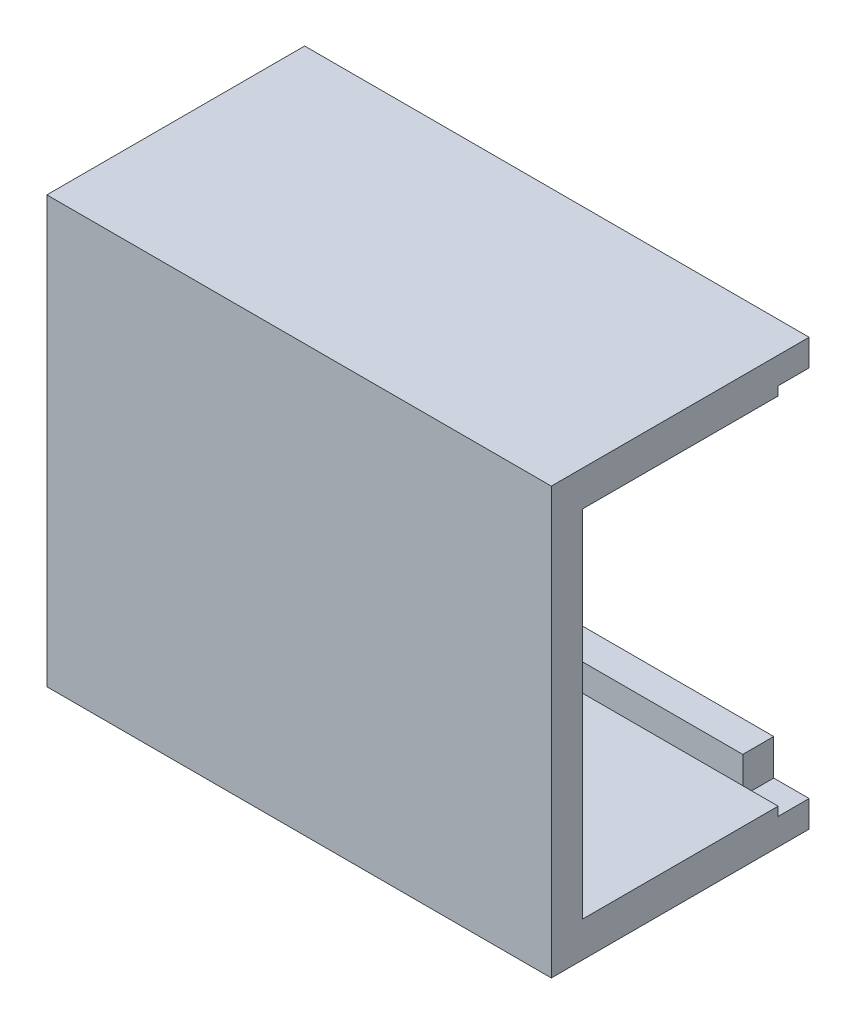
from build123d import *

# Parameters (mm, degrees)
SKETCH1_W           = 24.0664
SKETCH1_H           = 28.5
BOSS_EXTRUDE1_DEPTH = 14.5651
CUT_EXTRUDE1_DEPTH  = 35.193421008
CUT_EXTRUDE2_DEPTH  = 2


with BuildPart() as part:
    # Sketch1 → Boss-Extrude1 (new body)
    with BuildSketch(Plane(origin=(0, 0, 0), x_dir=(0, 1, 0), z_dir=(0, 0, 1))):
        Rectangle(SKETCH1_W, SKETCH1_H)
    extrude(amount=BOSS_EXTRUDE1_DEPTH)

    # Sketch2 → Cut-Extrude1 (cut, through all)
    with BuildSketch(Plane.YZ.offset(14.25)):
        Polygon((-10.0332, 12.8151), (10.0332, 12.8151), (10.0332, 1.75), (8.5, 1.75), (8.5, 0), (-8.5, 0), (-8.5, 1.75), (-10.0332, 1.75), align=None)
    extrude(amount=-CUT_EXTRUDE1_DEPTH, mode=Mode.SUBTRACT)

    # Sketch4 → Cut-Extrude2 (cut)
    with BuildSketch(Plane.YZ.offset(14.25)):
        Polygon((10.0332, 1.75), (10.5332, 1.75), (10.5332, 0), (8.5, 0), (8.5, 1.75), align=None)
        Polygon((-10.5332, 0), (-10.5332, 1.75), (-10.0332, 1.75), (-8.5, 1.75), (-8.5, 0), align=None)
    extrude(amount=-CUT_EXTRUDE2_DEPTH, mode=Mode.SUBTRACT)


solid = part.part
